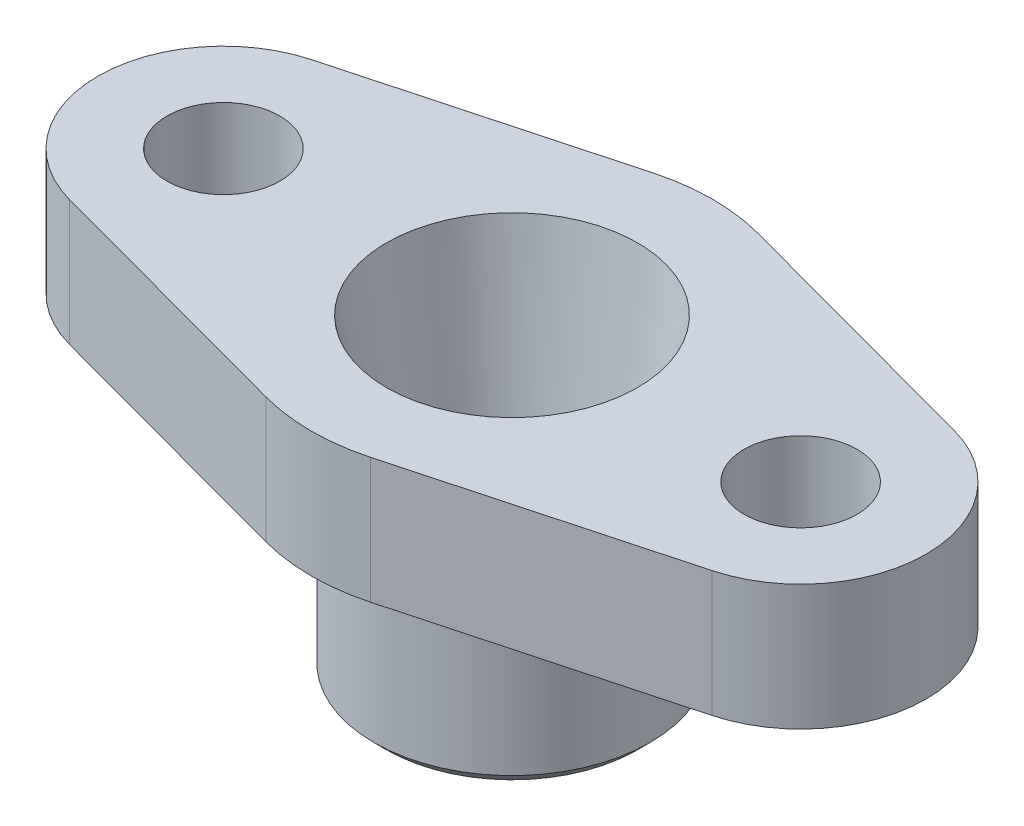
from build123d import *

# Parameters (mm, degrees)
SKETCH_1_R      = 4.5
EXTRUDE_1_DEPTH = 10
SKETCH_2_R      = 11
EXTRUDE_2_DEPTH = 25
FILLET_1_R      = 2
CHAMFER_1_SIZE  = 1


with BuildPart() as part:
    # Эскиз1 → Бобышка-Вытянуть1 (new body)
    with BuildSketch(Plane(origin=(0, 0, 0), x_dir=(1, 0, 0), z_dir=(0, 1, 0))):
        with BuildLine():
            Line((-25.608695652, 9.65374057), (-4.173913043, 15.445984912))
            ThreePointArc((-4.173913043, 15.445984912), (0, 16), (4.173913043, 15.445984912))
            Line((4.173913043, 15.445984912), (25.608695652, 9.65374057))
            ThreePointArc((25.608695652, 9.65374057), (33, 0), (25.608695652, -9.65374057))
            Line((25.608695652, -9.65374057), (4.173913043, -15.445984912))
            ThreePointArc((4.173913043, -15.445984912), (0, -16), (-4.173913043, -15.445984912))
            Line((-4.173913043, -15.445984912), (-25.608695652, -9.65374057))
            ThreePointArc((-25.608695652, -9.65374057), (-33, 0), (-25.608695652, 9.65374057))
        make_face()
        with Locations(Location((-23, 0, 0), (0, 0, 270))):
            Circle(SKETCH_1_R, mode=Mode.SUBTRACT)
        with Locations(Location((23, 0, 0), (0, 0, 90))):
            Circle(SKETCH_1_R, mode=Mode.SUBTRACT)
    extrude(amount=-EXTRUDE_1_DEPTH)

    # Эскиз2 → Бобышка-Вытянуть2 (add)
    with BuildSketch(Plane(origin=(0, 0, 0), x_dir=(1, 0, 0), z_dir=(0, 1, 0))):
        with Locations(Location((0, 0, 0), (0, 0, 270))):
            Circle(SKETCH_2_R)
    extrude(amount=-EXTRUDE_2_DEPTH)

    # Эскиз3 → Вырез-Повернуть1 (revolve, cut)
    with BuildSketch(Plane.XY, mode=Mode.PRIVATE) as cut_revolve_1_sk:
        with BuildLine():
            Line((0, 0), (-10, 0))
            Line((-10, 0), (-8.122654092, -13.141421356))
            ThreePointArc((-8.122654092, -13.141421356), (-7.78790634, -13.755453955), (-7.132704598, -14))
            Line((-7.132704598, -14), (-6, -14))
            Line((-6, -14), (-6, -25))
            Line((-6, -25), (0, -25))
            Line((0, -25), (0, 0))
        make_face()
    revolve(cut_revolve_1_sk.sketch.rotate(Axis((0, 4.006279318, 0), (0, -1, 0)), 270), axis=Axis((0, 4.006279318, 0), (0, -1, 0)), mode=Mode.SUBTRACT)

    # Скругление1
    fillet_1_edges = [part.edges().sort_by_distance(p)[0] for p in [
        (0, -10, -11),
    ]]
    fillet(fillet_1_edges, radius=FILLET_1_R)

    # Фаска1
    chamfer_1_edges = [part.edges().sort_by_distance(p)[0] for p in [
        (0, -25, -11),
    ]]
    chamfer(chamfer_1_edges, length=CHAMFER_1_SIZE)


solid = part.part
